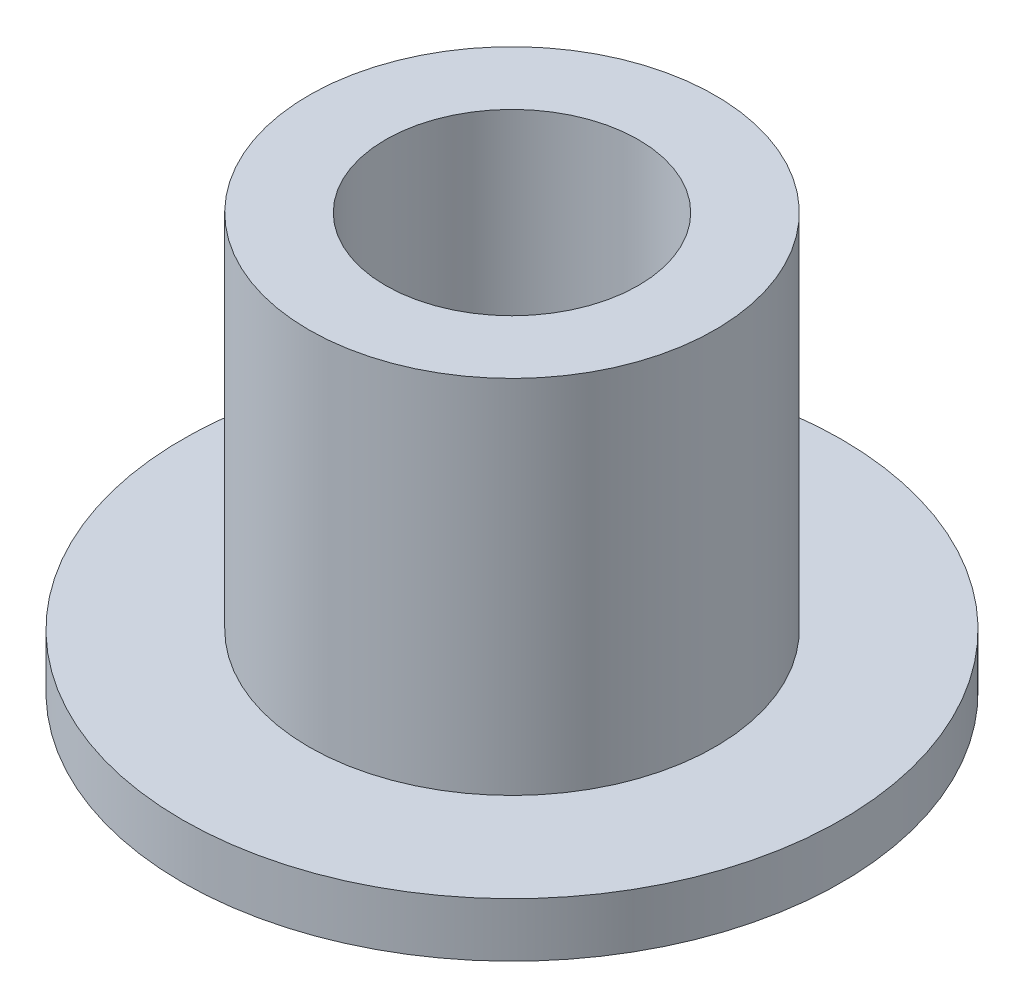
from build123d import *

# Parameters (mm, degrees)
SKETCH1_R                = 23.1775
SKETCH1_R_2              = 14.2875
BOSS_EXTRUDE2_DEPTH      = 3.81
BOSS_EXTRUDE3_DEPTH      = 25.4
BOSS_EXTRUDE3_DEPTH_BACK = 3.81
SKETCH1_4_R              = 14.2875
SKETCH1_4_R_2            = 8.89


with BuildPart() as part:
    # Sketch1 → Boss-Extrude2 (new body)
    with BuildSketch(Plane(origin=(0, 0, 0), x_dir=(1, 0, 0), z_dir=(0, 1, 0))):
        with Locations(Location((0, 0, 0), (0, 0, 270))):
            Circle(SKETCH1_R)
        with Locations(Location((0, 0, 0), (0, 0, 270))):
            Circle(SKETCH1_R_2, mode=Mode.SUBTRACT)
    extrude(amount=-BOSS_EXTRUDE2_DEPTH)

    # Sketch1<4> → Boss-Extrude3 (add, two sides: drawn at the far end of the back side and taken through both)
    with BuildSketch(Plane(origin=(0, 0, 0), x_dir=(1, 0, 0), z_dir=(0, 1, 0)).offset(-BOSS_EXTRUDE3_DEPTH_BACK)):
        with Locations(Location((0, 0, 0), (0, 0, 270))):
            Circle(SKETCH1_4_R)
        with Locations(Location((0, 0, 0), (0, 0, 270))):
            Circle(SKETCH1_4_R_2, mode=Mode.SUBTRACT)
    extrude(amount=BOSS_EXTRUDE3_DEPTH + BOSS_EXTRUDE3_DEPTH_BACK)


solid = part.part
